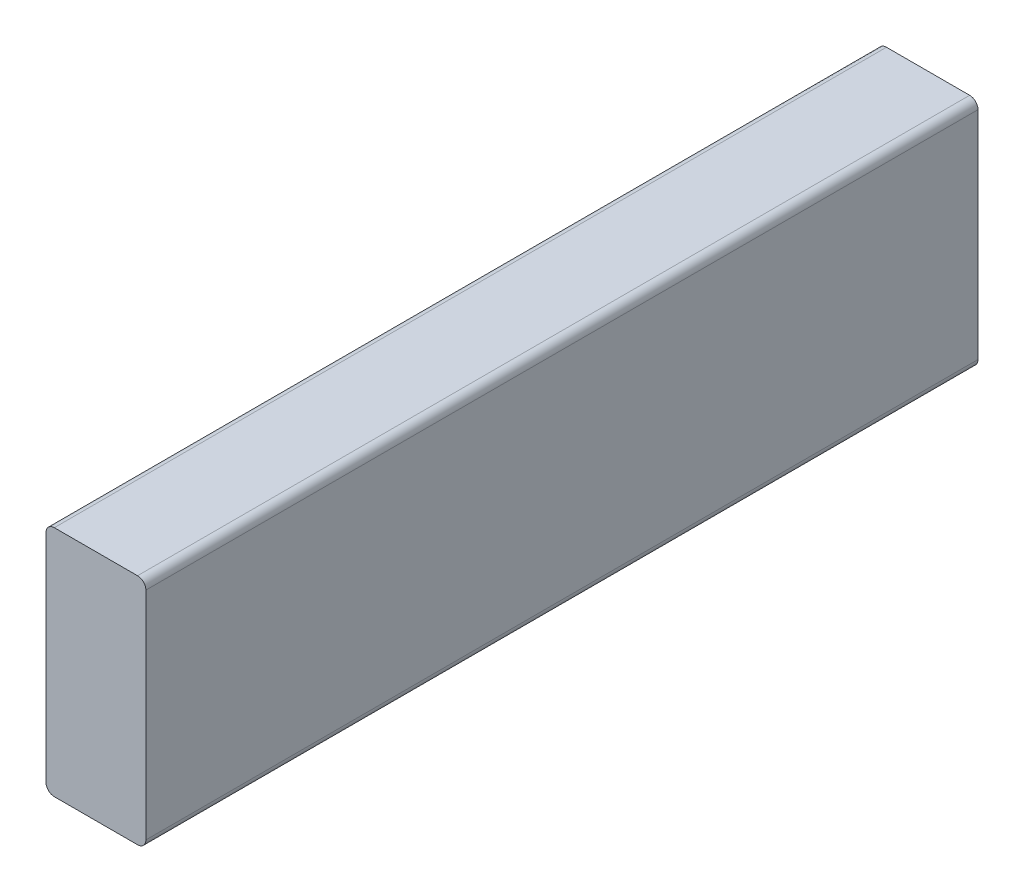
from build123d import *

# Parameters (mm, degrees)
SKETCH1_W           = 317.5
SKETCH1_H           = 88.9
BOSS_EXTRUDE1_DEPTH = 19.05
FILLET1_R           = 3.175


with BuildPart() as part:
    # Sketch1 → Boss-Extrude1 (new, symmetric)
    with BuildSketch(Plane(origin=(0, 0, 0), x_dir=(0, 0, -1), z_dir=(1, 0, 0))):
        with Locations((0, 44.45)):
            Rectangle(SKETCH1_W, SKETCH1_H)
    extrude(amount=BOSS_EXTRUDE1_DEPTH, both=True)

    # Fillet1
    fillet1_edges = [part.edges().sort_by_distance(p)[0] for p in [
        (19.05, 88.9, 0),
        (-19.05, 88.9, 0),
        (-19.05, 0, 0),
        (19.05, 0, 0),
    ]]
    fillet(fillet1_edges, radius=FILLET1_R)


solid = part.part
